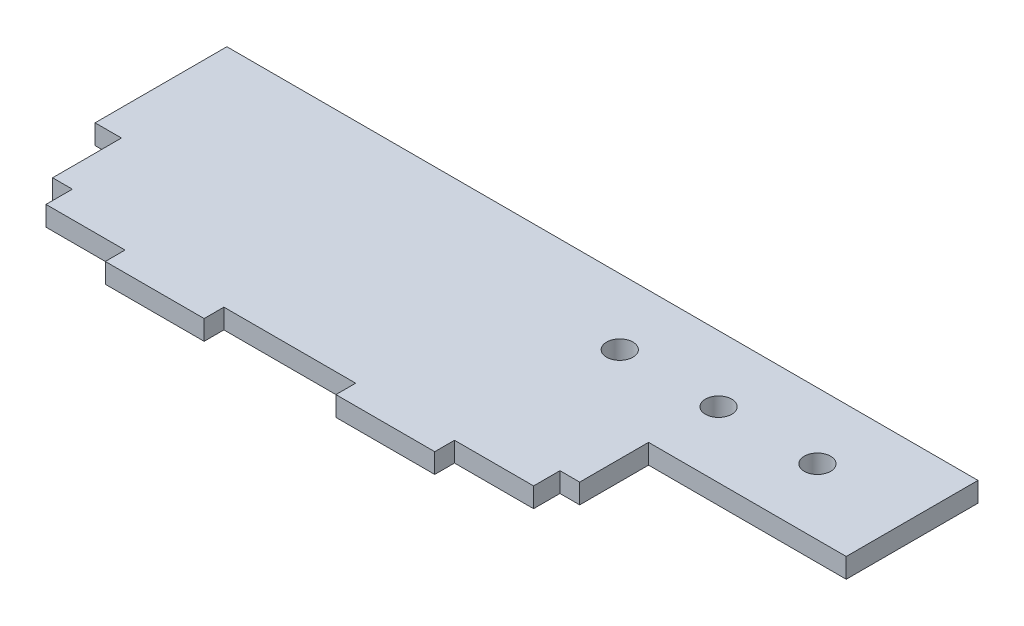
from build123d import *

# Parameters (mm, degrees)
SKETCH_1_W          = 80
SKETCH_1_H          = 34.45
SKETCH_1_W_2        = 15
SKETCH_1_H_2        = 3
SKETCH_1_W_3        = 30
SKETCH_1_H_3        = 20
SKETCH_1_W_4        = 4
EXTRUDE_1_DEPTH     = 3
SKETCH_2_R          = 2
CUT_EXTRUDE_1_DEPTH = 10
SKETCH_3_W          = 3
SKETCH_3_H          = 4
CUT_EXTRUDE_2_DEPTH = 3


with BuildPart() as part:
    # 草图1 → 凸台-拉伸1 (new body)
    with BuildSketch(Plane(origin=(0, 0, 0), x_dir=(1, 0, 0), z_dir=(0, 1, 0))):
        Rectangle(SKETCH_1_W, SKETCH_1_H)
        with Locations((-17.5, -18.725)):
            Rectangle(SKETCH_1_W_2, SKETCH_1_H_2)
        with Locations((17.5, -18.725)):
            Rectangle(SKETCH_1_W_2, SKETCH_1_H_2)
        with Locations((55, 7.225)):
            Rectangle(SKETCH_1_W_3, SKETCH_1_H_3)
        with Locations((-42, 7.225)):
            Rectangle(SKETCH_1_W_4, SKETCH_1_H_3)
    extrude(amount=EXTRUDE_1_DEPTH)

    # 草图2 → 切除-拉伸1 (cut)
    with BuildSketch(Plane(origin=(0, 3, 0), x_dir=(1, 0, 0), z_dir=(0, 1, 0))):
        with Locations(Location((55.63, 7.225, 0), (0, 0, 270))):
            Circle(SKETCH_2_R)
        with Locations(Location((40.63, 7.225, 0), (0, 0, 270))):
            Circle(SKETCH_2_R)
        with Locations(Location((25.63, 7.225, 0), (0, 0, 270))):
            Circle(SKETCH_2_R)
    extrude(amount=-CUT_EXTRUDE_1_DEPTH, mode=Mode.SUBTRACT)

    # 草图3 → 切除-拉伸2 (cut)
    with BuildSketch(Plane(origin=(0, 3, 0), x_dir=(1, 0, 0), z_dir=(0, 1, 0))):
        with Locations((-38.5, -15.225)):
            Rectangle(SKETCH_3_W, SKETCH_3_H)
        with Locations((38.5, -15.225)):
            Rectangle(SKETCH_3_W, SKETCH_3_H)
    extrude(amount=-CUT_EXTRUDE_2_DEPTH, mode=Mode.SUBTRACT)


solid = part.part
